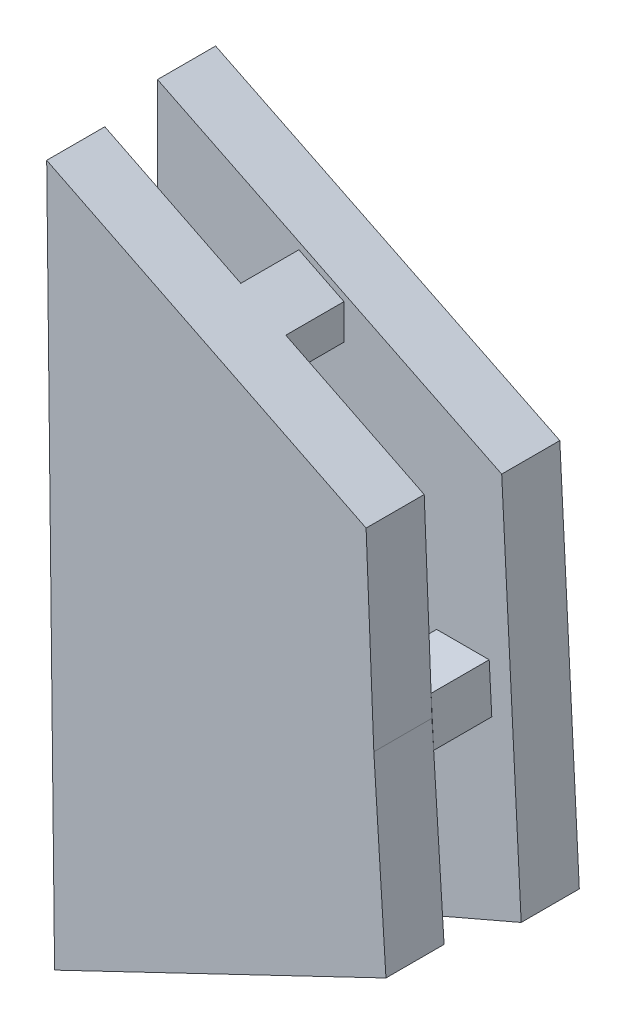
from build123d import *

# Parameters (mm, degrees)
BOSS_EXTRUDE1_DEPTH = 10
BOSS_EXTRUDE2_DEPTH = 10
BOSS_EXTRUDE3_DEPTH = 10


with BuildPart() as part:
    # Sketch20 → Boss-Extrude1 (new body)
    with BuildSketch(Plane.XY):
        Polygon((-2.790049513, 109.432186673), (-1.434483855, -10.567813327), (55.586408616, 16.767282175), (53.501321505, 49.432186673), (52.169506721, 82.106882469), align=None)
    extrude(amount=BOSS_EXTRUDE1_DEPTH)

    # Sketch21 → Boss-Extrude2 (add)
    with BuildSketch(Plane(origin=(0, 0, 0), x_dir=(-1, 0, 0), z_dir=(0, 0, -1))):
        Polygon((2.153425382, 53.075716438), (-6.504020667, 53.075716438), (-6.504020667, 44.793833992), (2.059870087, 44.793833992), align=None)
        Polygon((-53.35281188, 53.075716438), (-44.305813439, 53.075716438), (-44.305813439, 44.793833992), (-53.797399805, 44.793833992), align=None)
        Polygon((-20.609929611, 0), (-20.609929611, 9.183356753), (-28.35805903, 10.939673778), (-28.35805903, 3.714355361), align=None)
        Polygon((-28.35805903, 93.945679874), (-28.35805903, 87.903711829), (-20.609929611, 87.903711829), (-20.609929611, 97.797967044), align=None)
    extrude(amount=BOSS_EXTRUDE2_DEPTH)

    # Sketch22 → Boss-Extrude3 (add)
    with BuildSketch(Plane(origin=(0, 0, -10), x_dir=(-1, 0, 0), z_dir=(0, 0, -1))):
        Polygon((-24.483994321, 1.85717768), (2.707182476, -11.177928968), (3.725282972, 78.948328543), (3.725282972, 110.997079558), (-55.502382997, 81.814284871), (-58.856312716, 16.677185524), align=None)
    extrude(amount=BOSS_EXTRUDE3_DEPTH)


solid = part.part
